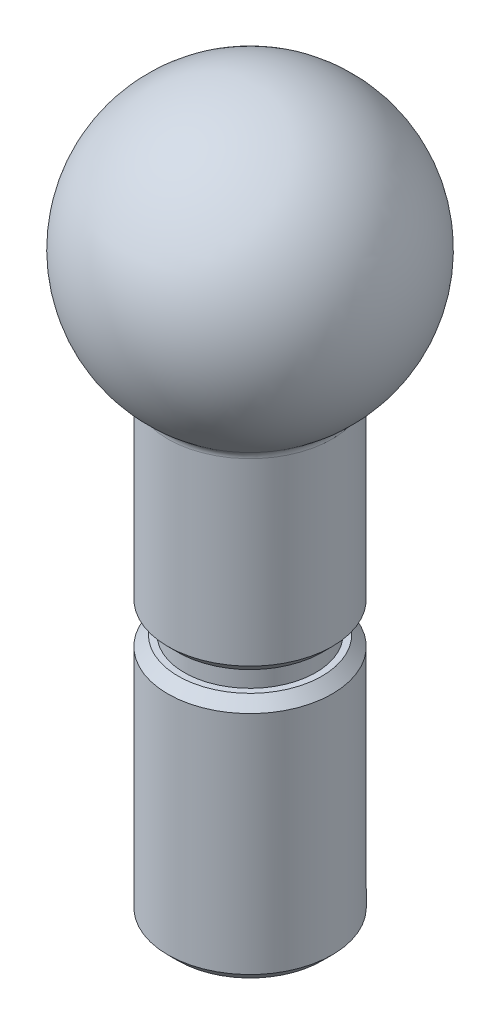
from build123d import *

# Parameters (mm, degrees)
SKETCH2_R          = 40
SKETCH2_R_2        = 32
CUT_EXTRUDE1_DEPTH = 10
FILLET1_R          = 5
CHAMFER1_SIZE      = 5


with BuildPart() as part:
    # Sketch1 → Revolve1 (revolve)
    with BuildSketch(Plane.XY):
        with BuildLine():
            Line((40, -57.445626465), (40, -282.445626465))
            Line((40, -282.445626465), (0, -282.445626465))
            Line((0, -282.445626465), (0, 70))
            ThreePointArc((0, 70), (66.787700412, 20.961943462), (40, -57.445626465))
        make_face()
    revolve(axis=Axis((0, 0, 0), (0, -1, 0)))

    # Sketch2 → Cut-Extrude1 (cut)
    with BuildSketch(Plane(origin=(0, -162.445626465, 0), x_dir=(-1, 0, 0), z_dir=(0, -1, 0))):
        with Locations(Location((0, 0, 0), (0, 0, 270))):
            Circle(SKETCH2_R)
        with Locations(Location((0, 0, 0), (0, 0, 90))):
            Circle(SKETCH2_R_2, mode=Mode.SUBTRACT)
    extrude(amount=-CUT_EXTRUDE1_DEPTH, mode=Mode.SUBTRACT)

    # Fillet1
    fillet1_edges = [part.edges().sort_by_distance(p)[0] for p in [
        (-40, -57.445626465, 0),
    ]]
    fillet(fillet1_edges, radius=FILLET1_R)

    # Chamfer1
    chamfer1_edges = [part.edges().sort_by_distance(p)[0] for p in [
        (-40, -152.445626465, 0),
        (-40, -162.445626465, 0),
        (-40, -282.445626465, 0),
    ]]
    chamfer(chamfer1_edges, length=CHAMFER1_SIZE)


solid = part.part
